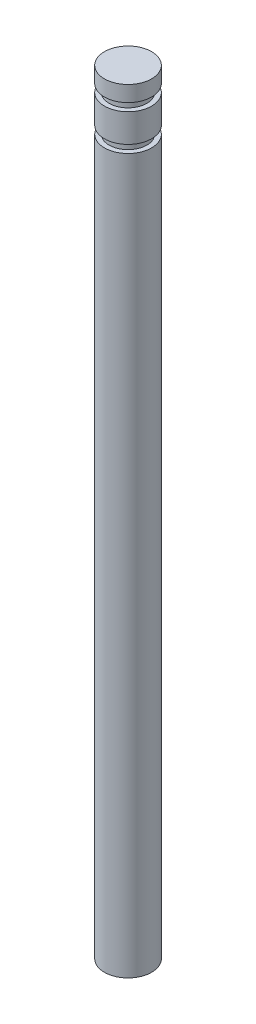
from build123d import *


with BuildPart() as part:
    # Эскиз2 → Повернуть1 (revolve)
    with BuildSketch(Plane(origin=(0, 0, 0), x_dir=(0, 0, -1), z_dir=(1, 0, 0))):
        Polygon((0, 49.2), (0, 0), (1.5, 0), (1.5, 45.4), (1.2, 45.4), (1.2, 45.9), (1.5, 45.9), (1.5, 47.7), (1.2, 47.7), (1.2, 48.2), (1.5, 48.2), (1.5, 49.2), align=None)
    revolve(axis=Axis((0, 0, 0), (0, 1, 0)))


solid = part.part
